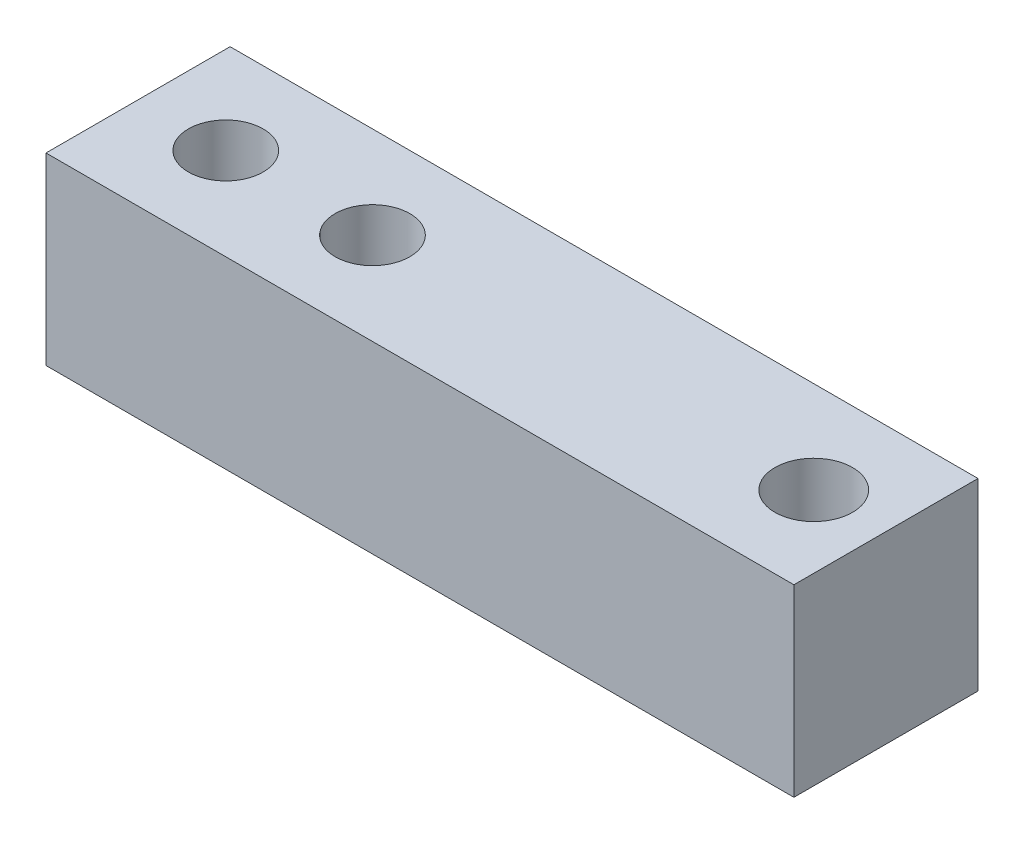
from build123d import *

# Parameters (mm, degrees)
SKETCH1_W           = 130
SKETCH1_H           = 32
BOSS_EXTRUDE1_DEPTH = 32
SKETCH2_R           = 6.5
SKETCH2_R_2         = 6.75
CUT_EXTRUDE1_DEPTH  = 32


with BuildPart() as part:
    # Sketch1 → Boss-Extrude1 (new body)
    with BuildSketch(Plane(origin=(0, 0, 0), x_dir=(1, 0, 0), z_dir=(0, 1, 0))):
        Rectangle(SKETCH1_W, SKETCH1_H)
    extrude(amount=BOSS_EXTRUDE1_DEPTH)

    # Sketch2 → Cut-Extrude1 (cut)
    with BuildSketch(Plane(origin=(0, 32, 0), x_dir=(1, 0, 0), z_dir=(0, 1, 0))):
        with Locations(Location((-49.75, 0, 0), (0, 0, 270))):
            Circle(SKETCH2_R)
        with Locations(Location((-24.25, 0, 0), (0, 0, 270))):
            Circle(SKETCH2_R)
        with Locations(Location((52.45, 0, 0), (0, 0, 270))):
            Circle(SKETCH2_R_2)
    extrude(amount=-CUT_EXTRUDE1_DEPTH, mode=Mode.SUBTRACT)


solid = part.part
